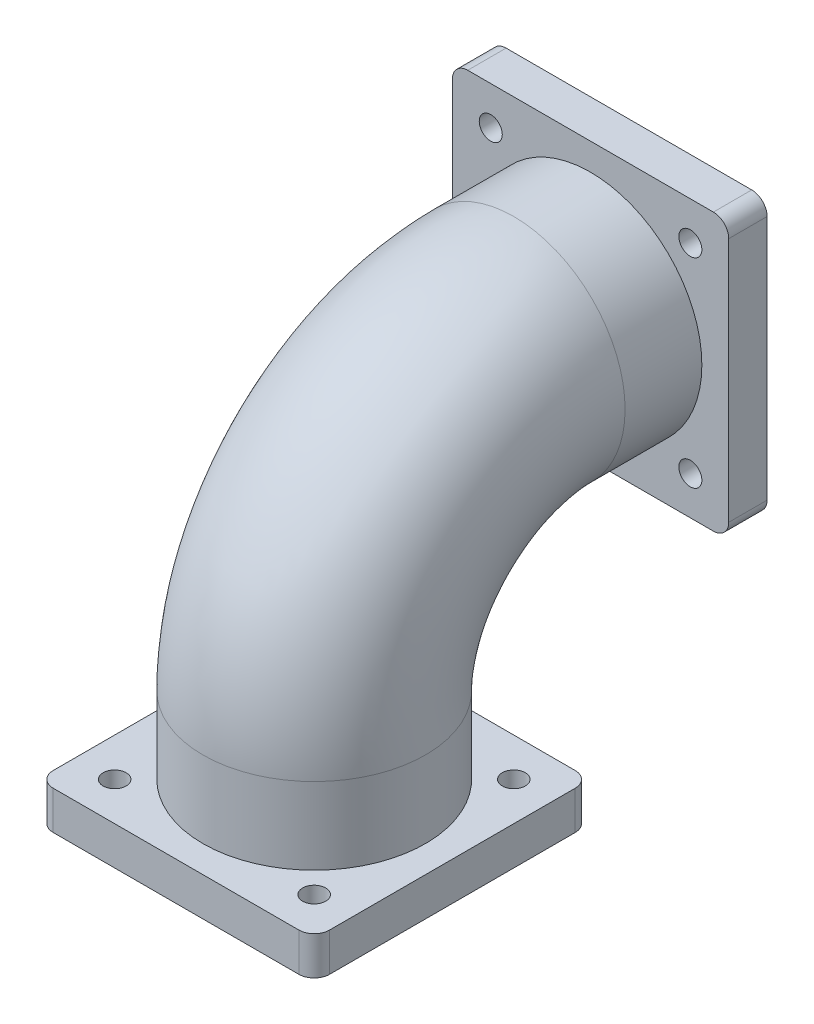
from build123d import *

# Parameters (mm, degrees)
SKETCH1_R           = 30
SKETCH1_R_2         = 105
SKETCH1_R_3         = 15
BOSS_EXTRUDE1_DEPTH = 50
SKETCH3_R           = 30
SKETCH3_R_2         = 15
CUT_EXTRUDE1_DEPTH  = 10
SKETCH5_R           = 145
SKETCH5_R_2         = 105
CIRPATTERN1_COUNT   = 2


with BuildPart() as part:
    # Sketch1 → Boss-Extrude1 (new body)
    # profile 1 of 5: a face of its own
    with BuildSketch(Plane.XY):
        with BuildLine():
            Line((20, 0), (340, 0))
            ThreePointArc((340, 0), (354.142135624, 5.857864376), (360, 20))
            Line((360, 20), (360, 340))
            ThreePointArc((360, 340), (354.142135624, 354.142135624), (340, 360))
            Line((340, 360), (20, 360))
            ThreePointArc((20, 360), (5.857864376, 354.142135624), (0, 340))
            Line((0, 340), (0, 20))
            ThreePointArc((0, 20), (5.857864376, 5.857864376), (20, 0))
        make_face()
        with Locations((50, 310)):
            Circle(SKETCH1_R, mode=Mode.SUBTRACT)
        with Locations((180, 180)):
            Circle(SKETCH1_R_2, mode=Mode.SUBTRACT)
        with Locations((310, 310)):
            Circle(SKETCH1_R, mode=Mode.SUBTRACT)
        with Locations((310, 50)):
            Circle(SKETCH1_R, mode=Mode.SUBTRACT)
        with Locations((50, 50)):
            Circle(SKETCH1_R, mode=Mode.SUBTRACT)
    # profile 2 of 5: a face of its own
    with BuildSketch(Plane.XY):
        with Locations((50, 310)):
            Circle(SKETCH1_R)
        with Locations((50, 310)):
            Circle(SKETCH1_R_3, mode=Mode.SUBTRACT)
    # profile 3 of 5: a face of its own
    with BuildSketch(Plane.XY):
        with Locations((310, 310)):
            Circle(SKETCH1_R)
        with Locations((310, 310)):
            Circle(SKETCH1_R_3, mode=Mode.SUBTRACT)
    # profile 4 of 5: a face of its own
    with BuildSketch(Plane.XY):
        with Locations((50, 50)):
            Circle(SKETCH1_R)
        with Locations((50, 50)):
            Circle(SKETCH1_R_3, mode=Mode.SUBTRACT)
    # profile 5 of 5: a face of its own
    with BuildSketch(Plane.XY):
        with Locations((310, 50)):
            Circle(SKETCH1_R)
        with Locations((310, 50)):
            Circle(SKETCH1_R_3, mode=Mode.SUBTRACT)
    boss_extrude1 = extrude(amount=BOSS_EXTRUDE1_DEPTH)

    # Sketch3 → Cut-Extrude1 (cut)
    # profile 1 of 4: a face of its own
    with BuildSketch(Plane(origin=(0, 0, 0), x_dir=(-1, 0, 0), z_dir=(0, 0, -1))):
        with Locations((-50, 310)):
            Circle(SKETCH3_R)
        with Locations((-50, 310)):
            Circle(SKETCH3_R_2, mode=Mode.SUBTRACT)
    # profile 2 of 4: a face of its own
    with BuildSketch(Plane(origin=(0, 0, 0), x_dir=(-1, 0, 0), z_dir=(0, 0, -1))):
        with Locations((-310, 310)):
            Circle(SKETCH3_R)
        with Locations((-310, 310)):
            Circle(SKETCH3_R_2, mode=Mode.SUBTRACT)
    # profile 3 of 4: a face of its own
    with BuildSketch(Plane(origin=(0, 0, 0), x_dir=(-1, 0, 0), z_dir=(0, 0, -1))):
        with Locations((-310, 50)):
            Circle(SKETCH3_R)
        with Locations((-310, 50)):
            Circle(SKETCH3_R_2, mode=Mode.SUBTRACT)
    # profile 4 of 4: a face of its own
    with BuildSketch(Plane(origin=(0, 0, 0), x_dir=(-1, 0, 0), z_dir=(0, 0, -1))):
        with Locations((-50, 50)):
            Circle(SKETCH3_R)
        with Locations((-50, 50)):
            Circle(SKETCH3_R_2, mode=Mode.SUBTRACT)
    cut_extrude1 = extrude(amount=-CUT_EXTRUDE1_DEPTH, mode=Mode.SUBTRACT)

    # Sweep1: sweep along a path in Sketch4
    with BuildLine(Plane(origin=(180, 0, 0), x_dir=(0, 0, -1), z_dir=(1, 0, 0))) as sweep1_path:
        Line((-50, 180), (-150, 180))
        ThreePointArc((-150, 180), (-333.847763109, 103.847763109), (-410, -80))
        Line((-410, -80), (-410, -230))
    # Sketch5 → Sweep1 (sweep)
    with BuildSketch(Plane.XY.offset(50)):
        with Locations((180, 180)):
            Circle(SKETCH5_R)
        with Locations((180, 180)):
            Circle(SKETCH5_R_2, mode=Mode.SUBTRACT)
    sweep(path=sweep1_path.line)

    # CirPattern1: Boss-Extrude1, Cut-Extrude1 ×2 about axis
    cirpattern1_axis = Axis((180, -80, 150), (0, 0.7071067811865438, 0.7071067811865512))
    add([boss_extrude1.rotate(cirpattern1_axis, i * 360 / CIRPATTERN1_COUNT) for i in range(1, CIRPATTERN1_COUNT)])
    add([cut_extrude1.rotate(cirpattern1_axis, i * 360 / CIRPATTERN1_COUNT) for i in range(1, CIRPATTERN1_COUNT)], mode=Mode.SUBTRACT)


solid = part.part
